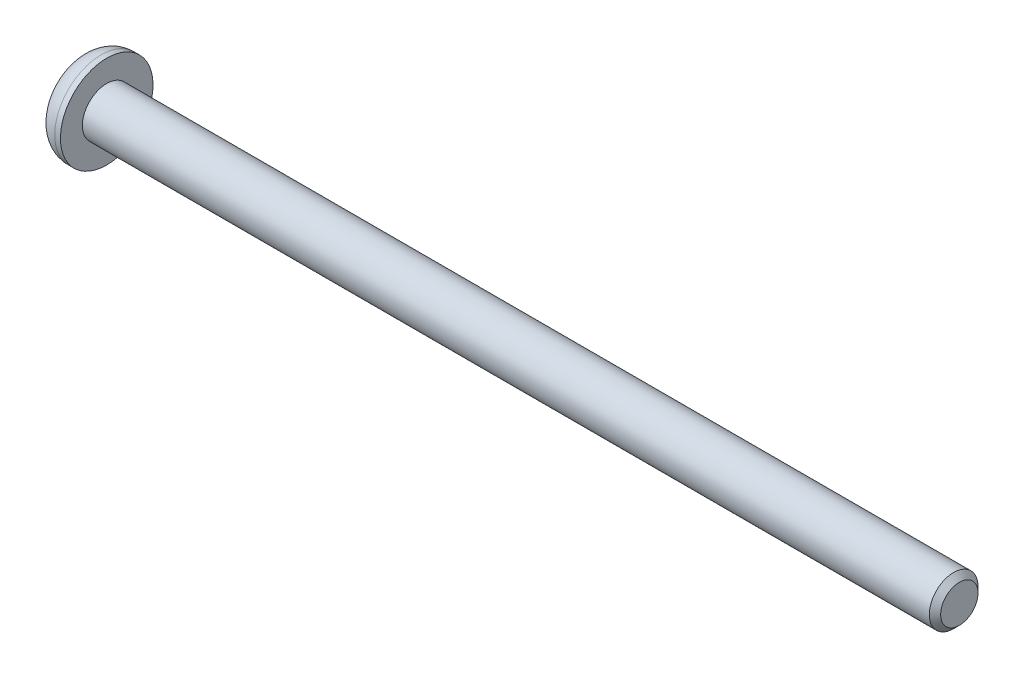
from build123d import *

# Parameters (mm, degrees)
PAH1_SIZE             = 0.7
KES_EKSTR_ZYON1_DEPTH = 1.5


with BuildPart() as part:
    # Çizim1 → Döndür1 (revolve)
    with BuildSketch(Plane.XY, mode=Mode.PRIVATE) as d_nd_r1_sk:
        with BuildLine():
            Line((0, 0), (108.3, 0))
            Line((108.3, 0), (108.3, 3))
            Line((108.3, 3), (3.3, 3))
            Line((3.3, 3), (3.3, 5.7))
            Line((3.3, 5.7), (2.6, 5.7))
            ThreePointArc((2.6, 5.7), (0.671107831, 4.848726189), (0, 2.85))
            Line((0, 2.85), (0, 0))
        make_face()
    revolve(d_nd_r1_sk.sketch.rotate(Axis((0, 0, 0), (1, 0, 0)), 180), axis=Axis((0, 0, 0), (1, 0, 0)))

    # Pah1
    pah1_edges = [part.edges().sort_by_distance(p)[0] for p in [
        (108.3, 3, 0),
    ]]
    chamfer(pah1_edges, length=PAH1_SIZE)

    # Çizim2 → Kes-Ekstrüzyon1 (cut)
    with BuildSketch(Plane.ZY):
        Polygon((0, 1.645448267), (-1.425, 0.822724134), (-1.425, -0.822724134), (0, -1.645448267), (1.425, -0.822724134), (1.425, 0.822724134), align=None)
    extrude(amount=-KES_EKSTR_ZYON1_DEPTH, mode=Mode.SUBTRACT)


solid = part.part
